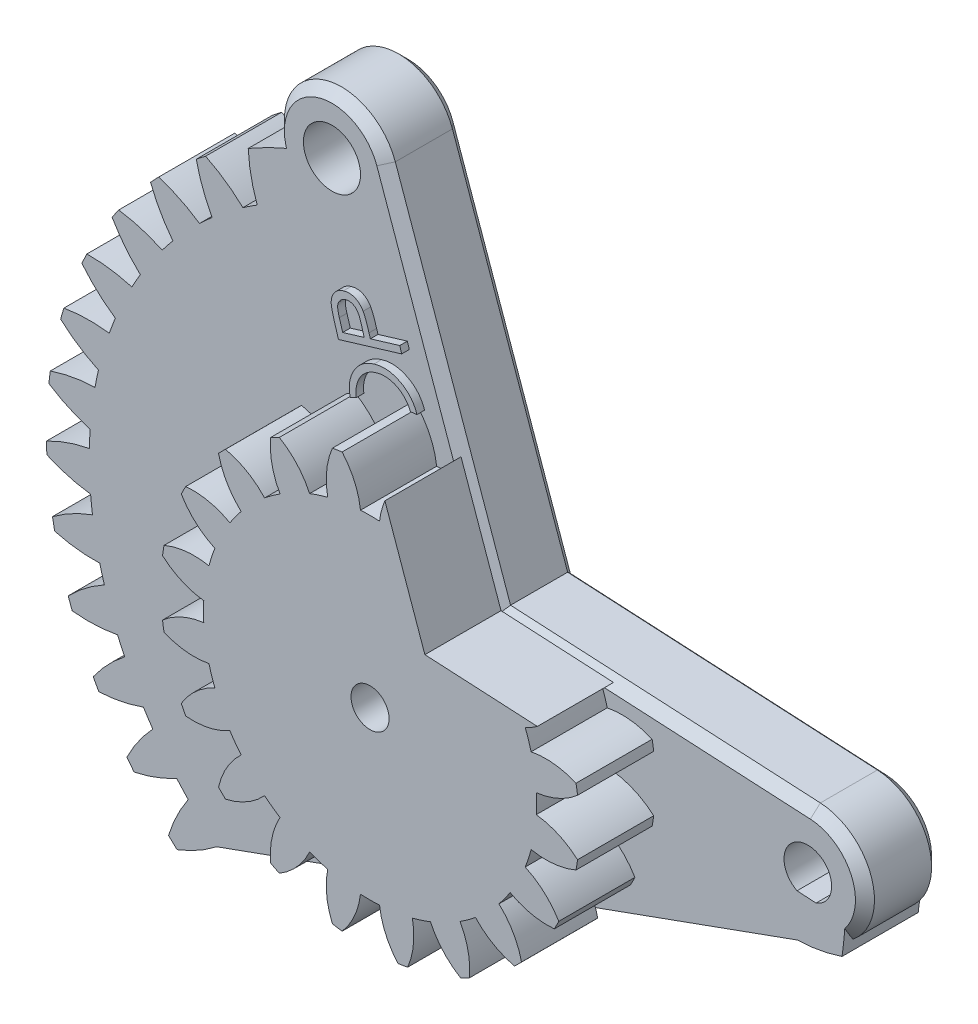
from build123d import *

# Parameters (mm, degrees)
CROQUIS1_R              = 1.5
CROQUIS1_R_2            = 1.25
SALIENTE_EXTRUIR1_DEPTH = 4
CROQUIS2_R              = 2.034729513
CROQUIS2_R_2            = 1.5
SALIENTE_EXTRUIR2_DEPTH = 4
CHAFL_N1_SIZE           = 0.5
SALIENTE_EXTRUIR5_DEPTH = 0.4
SALIENTE_EXTRUIR3_DEPTH = 4
CORTAR_EXTRUIR1_DEPTH   = 10
MATRIZC1_COUNT          = 26
MATRIZC1_ANGLE          = 225
CORTAR_EXTRUIR3_DEPTH   = 10
SALIENTE_EXTRUIR4_START = 4
CROQUIS7_R              = 11
CROQUIS7_R_2            = 1
SALIENTE_EXTRUIR4_DEPTH = 4
CORTAR_EXTRUIR2_DEPTH   = 4
MATRIZC2_COUNT          = 20
CORTAR_EXTRUIR4_DEPTH   = 33.817678254


with BuildPart() as part:
    # Croquis1 → Saliente-Extruir1 (new body)
    with BuildSketch(Plane.XY):
        with BuildLine():
            Line((0.210526316, 3.994455992), (19.157894737, 2.995841994))
            ThreePointArc((19.157894737, 2.995841994), (22, 0), (19.157894737, -2.995841994))
            Line((19.157894737, -2.995841994), (0.210526316, -3.994455992))
            ThreePointArc((0.210526316, -3.994455992), (-4, 0), (0.210526316, 3.994455992))
        make_face()
        Circle(CROQUIS1_R, mode=Mode.SUBTRACT)
        with Locations((19, 0)):
            Circle(CROQUIS1_R_2, mode=Mode.SUBTRACT)
    extrude(amount=SALIENTE_EXTRUIR1_DEPTH)

    # Croquis2 → Saliente-Extruir2 (add, through all)
    with BuildSketch(Plane.XY.offset(4)):
        with BuildLine():
            Line((-3.171102714, 20.998669186), (3.771863049, 1.331558915))
            ThreePointArc((3.771863049, 1.331558915), (1.149391542, -3.831305141), (-3.881954792, -0.964586438))
            Line((-3.881954792, -0.964586438), (-8.911466094, 19.276560172))
            ThreePointArc((-8.911466094, 19.276560172), (-6.862043657, 22.873478856), (-3.171102714, 20.998669186))
        make_face()
        Circle(CROQUIS2_R, mode=Mode.SUBTRACT)
        with Locations((-6, 20)):
            Circle(CROQUIS2_R_2, mode=Mode.SUBTRACT)
    extrude(amount=-SALIENTE_EXTRUIR2_DEPTH)

    # Chaflán1
    chafl_n1_edges = [part.edges().sort_by_distance(p)[0] for p in [
        (22, 0, 4),
        (11.01969335, 3.424762868, 4),
        (-2.380099608, -3.214829056, 0),
        (-2.380099608, -3.214829056, 4),
        (-0.144805375, 12.426176464, 0),
        (-0.144805375, 12.426176464, 4),
        (-6.862043657, 22.873478856, 4),
        (-6.396710443, 9.155986867, 4),
        (-6.862043657, 22.873478856, 0),
        (-6.396710443, 9.155986867, 0),
        (11.01969335, 3.424762868, 0),
        (22, 0, 0),
        (9.684210526, -3.495148993, 0),
        (9.684210526, -3.495148993, 4),
    ]]
    chamfer(chafl_n1_edges, length=CHAFL_N1_SIZE)

    # Croquis11 → Saliente-Extruir5 (add)
    # profile 1 of 3: a face of its own
    with BuildSketch(Plane.XY.offset(4)):
        Polygon((-3.019731571, 6.07953487), (-3.342247596, 5.98207894), (-3.892628205, 7.803593364), (-3.570112179, 7.901049293), (-3.346454327, 7.160664678), (-0.349158654, 8.065812915), (-0.246794872, 7.727171088), (-3.244090545, 6.822022851), align=None)
    # profile 2 of 3: a face of its own
    with BuildSketch(Plane.XY.offset(4)):
        with BuildLine():
            add(Edge.make_bspline(
                [(-4.600373639, 9.844689483), (-4.617377309, 9.906828363), (-4.650766398, 10.028846768), (-4.681106485, 10.213624807), (-4.692288801, 10.395654825), (-4.686093229, 10.574591738), (-4.662463744, 10.750968102), (-4.618925017, 10.92387398), (-4.558700516, 11.094366673), (-4.479898709, 11.259356988), (-4.387961102, 11.416997563), (-4.281592999, 11.562073237), (-4.163122185, 11.693330207), (-4.032717128, 11.810993871), (-3.890509527, 11.915341439), (-3.736003405, 12.005194828), (-3.569586544, 12.081887425), (-3.452133861, 12.120503488), (-3.392340787, 12.140162239)],
                knots=[0, 0, 0, 0, 1.067745278, 2.096667575, 3.098425571, 4.087252053, 5.061165424, 6.043370574, 7.038661181, 8.0545099, 9.070742928, 10.060563721, 11.03187526, 11.997713355, 12.968158645, 13.951189127, 14.956986788, 16, 16, 16, 16], degree=3))
            add(Edge.make_bspline(
                [(-3.392340787, 12.140162239), (-3.332324211, 12.156801675), (-3.213914126, 12.189630557), (-3.033785776, 12.217229453), (-2.855844807, 12.226924609), (-2.68001084, 12.220745313), (-2.506497695, 12.193974405), (-2.335145349, 12.150536487), (-2.166291028, 12.088099729), (-2.001433259, 12.009290658), (-1.844034202, 11.916465432), (-1.698744389, 11.809975317), (-1.566870376, 11.691918282), (-1.449346649, 11.561553374), (-1.345587824, 11.419593647), (-1.255671255, 11.266006476), (-1.179002269, 11.100578792), (-1.14080655, 10.983752204), (-1.121407293, 10.924417047)],
                knots=[0, 0, 0, 0, 1.041314901, 2.054468872, 3.04135589, 4.019684798, 4.992410558, 5.973026333, 6.972567252, 7.99922824, 9.026588938, 10.025311154, 11.008262918, 11.98278676, 12.956494417, 13.944991366, 14.956279872, 16, 16, 16, 16], degree=3))
            add(Edge.make_bspline(
                [(-1.121407293, 10.924417047), (-1.104538299, 10.86369875), (-1.071315214, 10.744115503), (-1.042968761, 10.56215905), (-1.03229356, 10.382787117), (-1.039012612, 10.205852396), (-1.064568798, 10.031267986), (-1.108384238, 9.859193995), (-1.169598227, 9.689269338), (-1.248854112, 9.524423963), (-1.341418986, 9.367272708), (-1.447377628, 9.222610001), (-1.563953179, 9.091430168), (-1.692563992, 8.974303652), (-1.832314042, 8.870660875), (-1.984405223, 8.782473131), (-2.146903484, 8.706095567), (-2.261907735, 8.668416413), (-2.320325562, 8.649276822)],
                knots=[0, 0, 0, 0, 1.055460304, 2.078704063, 3.079242884, 4.063167456, 5.040866377, 6.030760495, 7.034361416, 8.062787363, 9.091914224, 10.086878968, 11.063376702, 12.028241522, 12.997310911, 13.973407922, 14.970567571, 16, 16, 16, 16], degree=3))
            add(Edge.make_bspline(
                [(-2.320325562, 8.649276822), (-2.360165922, 8.638046645), (-2.439056147, 8.615809114), (-2.558934493, 8.591047635), (-2.678951753, 8.575392436), (-2.798769851, 8.56578164), (-2.918754888, 8.565076684), (-3.038350865, 8.573248107), (-3.158367398, 8.587563097), (-3.277411694, 8.611077428), (-3.395000903, 8.640545887), (-3.508565871, 8.678878999), (-3.618524946, 8.723021702), (-3.724483549, 8.774185722), (-3.826528495, 8.832678813), (-3.924530921, 8.89795828), (-4.019165386, 8.969517181), (-4.108340983, 9.048848382), (-4.192709181, 9.133051892), (-4.27117339, 9.221856869), (-4.342598981, 9.31526645), (-4.407859989, 9.412592087), (-4.466430631, 9.514249193), (-4.518281483, 9.620075519), (-4.563434008, 9.730448361), (-4.588000839, 9.80642482), (-4.600373639, 9.844689483)],
                knots=[0, 0, 0, 0, 1.040176587, 2.059714426, 3.073227228, 4.080593331, 5.079204126, 6.085747834, 7.091931532, 8.114932457, 9.133589983, 10.136665386, 11.124925803, 12.110126448, 13.091537305, 14.078819626, 15.068039731, 16.070994731, 17.076166284, 18.062539505, 19.047092008, 20.029486807, 21.005804061, 21.993575551, 22.98948758, 24, 24, 24, 24], degree=3))
        make_face()
        with BuildLine():
            add(Edge.make_bspline(
                [(-4.279259857, 9.958271213), (-4.269312302, 9.92800663), (-4.249511617, 9.867764741), (-4.213957968, 9.779798806), (-4.171280256, 9.695731506), (-4.124523618, 9.613772947), (-4.07091202, 9.535332359), (-4.012091333, 9.459746898), (-3.94794649, 9.386901193), (-3.878070632, 9.318152858), (-3.804427867, 9.253110233), (-3.726914792, 9.194126957), (-3.646864087, 9.140680125), (-3.563968451, 9.092855011), (-3.478374859, 9.05096344), (-3.390365819, 9.013886796), (-3.298996444, 8.984120371), (-3.205399833, 8.959482118), (-3.110043708, 8.941336952), (-3.013789456, 8.929345457), (-2.916829141, 8.923816087), (-2.819369473, 8.924261241), (-2.72125967, 8.932340326), (-2.622704546, 8.946365904), (-2.52325193, 8.96639471), (-2.457859974, 8.985346412), (-2.42479271, 8.994929867)],
                knots=[0, 0, 0, 0, 0.986488523, 1.963613084, 2.934660639, 3.904223514, 4.883864577, 5.874142664, 6.868907043, 7.887376029, 8.908003008, 9.909746802, 10.901399321, 11.887117554, 12.871133705, 13.851015371, 14.842060203, 15.844457459, 16.846619518, 17.845797621, 18.846285572, 19.852360406, 20.861554536, 21.892294059, 22.934179769, 24, 24, 24, 24], degree=3))
            add(Edge.make_bspline(
                [(-2.42479271, 8.994929867), (-2.376728112, 9.010508091), (-2.282070374, 9.041187624), (-2.148536839, 9.104131847), (-2.023883426, 9.17616203), (-1.908496334, 9.259237796), (-1.803906778, 9.354481993), (-1.708603781, 9.46044699), (-1.622741834, 9.577312494), (-1.547865176, 9.704133404), (-1.484528695, 9.83694442), (-1.43410054, 9.97267578), (-1.399049508, 10.110197067), (-1.377551393, 10.248964035), (-1.371535186, 10.389276358), (-1.379248334, 10.530890215), (-1.401572501, 10.673998445), (-1.427345989, 10.768044945), (-1.44041771, 10.815743169)],
                knots=[0, 0, 0, 0, 1.051357304, 2.070528206, 3.067300111, 4.046749293, 5.025387838, 6.007638833, 7.010358697, 8.040442992, 9.070228255, 10.071174544, 11.051010659, 12.020931756, 12.990523051, 13.970322897, 14.970594403, 16, 16, 16, 16], degree=3))
            add(Edge.make_bspline(
                [(-1.44041771, 10.815743169), (-1.450500785, 10.847447482), (-1.470531334, 10.910429734), (-1.50807923, 11.001683213), (-1.550669898, 11.089299028), (-1.598954748, 11.173043814), (-1.650949438, 11.254192838), (-1.710708747, 11.330358113), (-1.774004795, 11.404177239), (-1.843022803, 11.473331992), (-1.915263793, 11.538663369), (-1.992275812, 11.597325473), (-2.071093987, 11.651385133), (-2.153019171, 11.699815878), (-2.238537638, 11.740573253), (-2.326467761, 11.776673351), (-2.417347199, 11.806901609), (-2.510783782, 11.831325211), (-2.606124892, 11.849515103), (-2.702152612, 11.861457912), (-2.798872088, 11.867032017), (-2.896108604, 11.866621794), (-2.993691265, 11.858365905), (-3.091885471, 11.845302456), (-3.190495764, 11.825036051), (-3.255725842, 11.806598542), (-3.288574761, 11.797313681)],
                knots=[0, 0, 0, 0, 1.026287622, 2.038773261, 3.041891596, 4.030358601, 5.020534278, 6.012992347, 7.015073117, 8.019719906, 9.025918674, 10.018376742, 11.004552119, 11.974293191, 12.951647526, 13.925296163, 14.905971001, 15.904802431, 16.903399501, 17.899023229, 18.888752308, 19.891248233, 20.896852359, 21.908644242, 22.946823653, 24, 24, 24, 24], degree=3))
            add(Edge.make_bspline(
                [(-3.288574761, 11.797313681), (-3.320963418, 11.786956442), (-3.385023329, 11.766471374), (-3.477861705, 11.729157558), (-3.566290592, 11.686298589), (-3.650701466, 11.638326305), (-3.731389118, 11.586133745), (-3.807346679, 11.527982813), (-3.879984154, 11.465767793), (-3.947398796, 11.397775408), (-4.010904513, 11.326134972), (-4.068885864, 11.250776446), (-4.121225952, 11.171492583), (-4.167859954, 11.08882372), (-4.210316469, 11.00314761), (-4.246900393, 10.913663889), (-4.277562415, 10.820590115), (-4.30252182, 10.724764505), (-4.322592081, 10.627731352), (-4.334594822, 10.53017706), (-4.34234377, 10.433298526), (-4.341668398, 10.337037166), (-4.33677324, 10.241394147), (-4.323309476, 10.14647936), (-4.305976258, 10.051564818), (-4.288192592, 9.989464302), (-4.279259857, 9.958271213)],
                knots=[0, 0, 0, 0, 1.053169154, 2.083010774, 3.096537244, 4.095136452, 5.089158406, 6.070923408, 7.056471925, 8.049649788, 9.034506635, 10.020666609, 10.992557904, 11.974990074, 12.959314538, 13.952888158, 14.967138427, 15.99269561, 17.01927452, 18.034041473, 19.035785223, 20.027669181, 21.014015174, 22.000068834, 22.995434578, 24, 24, 24, 24], degree=3))
        make_face(mode=Mode.SUBTRACT)
    # profile 3 of 3: a face of its own
    with BuildSketch(Plane.XY.offset(4)):
        with BuildLine():
            Line((-5.25796548, 12.323086534), (-5.457785191, 12.984244387))
            add(Edge.make_bspline(
                [(-5.457785191, 12.984244387), (-5.47151454, 13.029766491), (-5.497786125, 13.116874611), (-5.532689891, 13.242503029), (-5.562961774, 13.356765318), (-5.588464232, 13.460025548), (-5.608673759, 13.552162755), (-5.624650106, 13.633158244), (-5.634831519, 13.703146838), (-5.637954751, 13.74634239), (-5.639375736, 13.765995188)],
                knots=[0, 0, 0, 0, 1.419308712, 2.715896286, 3.89196083, 4.947804328, 5.890657877, 6.707498429, 7.411947036, 8, 8, 8, 8], degree=3))
            add(Edge.make_bspline(
                [(-5.639375736, 13.765995188), (-5.640331526, 13.791242009), (-5.642218459, 13.841084619), (-5.636531353, 13.915110507), (-5.627189271, 13.987373008), (-5.611560252, 14.057694775), (-5.590767952, 14.126157853), (-5.562771427, 14.192103431), (-5.530765951, 14.256817409), (-5.493042658, 14.319173366), (-5.449515292, 14.377973881), (-5.400951238, 14.433117189), (-5.34688528, 14.483503669), (-5.287670149, 14.529530292), (-5.222738195, 14.569937703), (-5.153282711, 14.606576267), (-5.078414852, 14.638346679), (-5.026034248, 14.655408389), (-4.999251537, 14.664132207)],
                knots=[0, 0, 0, 0, 1.012920482, 1.999721077, 2.974462738, 3.934616193, 4.886722436, 5.841042668, 6.805582077, 7.781766065, 8.760783423, 9.737327659, 10.725864365, 11.721845111, 12.741686893, 13.790308956, 14.87016355, 16, 16, 16, 16], degree=3))
            add(Edge.make_bspline(
                [(-4.999251537, 14.664132207), (-4.972002755, 14.671753425), (-4.918615921, 14.6866852), (-4.83848582, 14.70227345), (-4.76014685, 14.710605596), (-4.683915586, 14.71310086), (-4.609536871, 14.707953837), (-4.537283554, 14.696772078), (-4.46668146, 14.679458378), (-4.398731975, 14.654345887), (-4.332616443, 14.624721783), (-4.270372717, 14.587816089), (-4.210929653, 14.546252936), (-4.154698844, 14.499027045), (-4.101568534, 14.446435808), (-4.051224176, 14.388615728), (-4.005199648, 14.324613984), (-3.977207317, 14.2791598), (-3.962993524, 14.256079323)],
                knots=[0, 0, 0, 0, 1.119054162, 2.192492843, 3.224727499, 4.232873013, 5.205809643, 6.169521406, 7.122529883, 8.075941903, 9.03163744, 9.984645917, 10.933699613, 11.898475174, 12.885672038, 13.888504215, 14.927836188, 16, 16, 16, 16], degree=3))
            add(Edge.make_bspline(
                [(-3.962993524, 14.256079323), (-3.952261918, 14.236557778), (-3.9288352, 14.193942936), (-3.895719848, 14.122062336), (-3.859899232, 14.037680497), (-3.82232609, 13.940616299), (-3.783275192, 13.830510156), (-3.740878211, 13.708063972), (-3.697979397, 13.572231844), (-3.668916388, 13.477388645), (-3.653798813, 13.428054483)],
                knots=[0, 0, 0, 0, 0.603734561, 1.317931202, 2.14400041, 3.088751276, 4.138835996, 5.310898922, 6.601222324, 8, 8, 8, 8], degree=3))
            Line((-3.653798813, 13.428054483), (-3.58228439, 13.191075316))
            Line((-3.58228439, 13.191075316), (-2.038414198, 13.65732131))
            Line((-2.038414198, 13.65732131), (-1.938153781, 13.325690701))
            Line((-1.938153781, 13.325690701), (-5.25796548, 12.323086534))
        make_face()
        with BuildLine():
            Line((-5.035709871, 12.752173073), (-3.906903781, 13.092918265))
            Line((-3.906903781, 13.092918265), (-4.069564037, 13.65732131))
            add(Edge.make_bspline(
                [(-4.069564037, 13.65732131), (-4.078101958, 13.684698471), (-4.09458299, 13.737545517), (-4.120210139, 13.813510218), (-4.14731918, 13.882585711), (-4.172488385, 13.946377837), (-4.200360108, 14.002667711), (-4.226521169, 14.053730656), (-4.253932313, 14.097884147), (-4.28991452, 14.148012923), (-4.338856134, 14.201869257), (-4.40512417, 14.254913729), (-4.478899268, 14.296242907), (-4.558361622, 14.326024064), (-4.641501128, 14.34434521), (-4.726296968, 14.349945953), (-4.811994961, 14.343301774), (-4.867838948, 14.328697243), (-4.896186633, 14.32128365)],
                knots=[0, 0, 0, 0, 1.139265612, 2.199162311, 3.183674442, 4.087102138, 4.921745157, 5.677589892, 6.365493384, 6.983916987, 8.127411625, 9.243864779, 10.34131839, 11.472497674, 12.60337212, 13.710677677, 14.837887631, 16, 16, 16, 16], degree=3))
            add(Edge.make_bspline(
                [(-4.896186633, 14.32128365), (-4.923186744, 14.312067035), (-4.976575286, 14.293842606), (-5.050235272, 14.251929009), (-5.117312808, 14.20076549), (-5.175730674, 14.13953092), (-5.225758902, 14.072395907), (-5.263154339, 13.998947412), (-5.289630161, 13.92190345), (-5.301225968, 13.853574049), (-5.302474616, 13.795208872), (-5.301383192, 13.745761634), (-5.295233376, 13.691034397), (-5.286113474, 13.630932022), (-5.273532539, 13.56536819), (-5.256089436, 13.494781012), (-5.237074672, 13.418281108), (-5.221275541, 13.36605712), (-5.213093685, 13.339012015)],
                knots=[0, 0, 0, 0, 1.160535196, 2.294778777, 3.43596018, 4.587863825, 5.732854997, 6.836201972, 7.932619965, 9.042852679, 9.64323445, 10.310261499, 11.057114524, 11.885576692, 12.787847795, 13.7766676, 14.848608427, 16, 16, 16, 16], degree=3))
            Line((-5.213093685, 13.339012015), (-5.035709871, 12.752173073))
        make_face(mode=Mode.SUBTRACT)
    extrude(amount=SALIENTE_EXTRUIR5_DEPTH)

    # Croquis5 → Saliente-Extruir3 (add, through all)
    with BuildSketch(Plane.XY.offset(4)):
        with BuildLine():
            Line((-8.12542173, 19.364336335), (-0.386924844, 0.922111254))
            ThreePointArc((-0.386924844, 0.922111254), (-0.578520438, -0.815667887), (0.998180987, -0.060288623))
            Line((0.998180987, -0.060288623), (20.961800718, -1.266061076))
            ThreePointArc((20.961800718, -1.266061076), (-12.148929201, -17.129025637), (-8.12542173, 19.364336335))
        make_face()
    extrude(amount=-SALIENTE_EXTRUIR3_DEPTH)

    # Croquis4 → Cortar-Extruir1 (cut)
    with BuildSketch(Plane.XY):
        with BuildLine():
            ThreePointArc((-9.927829924, 15.904816692), (-10.305597324, 15.662683831), (-10.677462175, 15.411580143))
            ThreePointArc((-10.677462175, 15.411580143), (-11.618969557, 16.172794781), (-12.664568115, 16.783210647))
            ThreePointArc((-12.664568115, 16.783210647), (-11.556846017, 17.564360373), (-10.401093383, 18.272512186))
            ThreePointArc((-10.401093383, 18.272512186), (-10.254302252, 17.070706778), (-9.927829924, 15.904816692))
        make_face()
    cortar_extruir1 = extrude(amount=CORTAR_EXTRUIR1_DEPTH, mode=Mode.SUBTRACT)

    # MatrizC1: Cortar-Extruir1 ×26 about axis
    matrizc1_axis = Axis((0, 0, 0), (0, 0, 1))
    for i in range(1, MATRIZC1_COUNT):
        add(cortar_extruir1.rotate(matrizc1_axis, i * MATRIZC1_ANGLE / (MATRIZC1_COUNT - 1)), mode=Mode.SUBTRACT)

    # Croquis9 → Cortar-Extruir3 (cut)
    with BuildSketch(Plane.XY.offset(4)):
        Polygon((-12.058511391, -14.356785992), (18.447738738, -3.347526918), (41.792644194, -9.999013948), (3.330495337, -34.929313287), (-27.12510491, -28.428214003), align=None)
    extrude(amount=-CORTAR_EXTRUIR3_DEPTH, mode=Mode.SUBTRACT)

    # Croquis7 → Saliente-Extruir4 (add)
    with BuildSketch(Plane.XY.offset(4).offset(SALIENTE_EXTRUIR4_START)):
        with Locations(Location((0, 0, 0), (0, 0, 114.920843364))):
            Circle(CROQUIS7_R)
        Circle(CROQUIS7_R_2, mode=Mode.SUBTRACT)
    extrude(amount=-SALIENTE_EXTRUIR4_DEPTH)

    # Croquis8 → Cortar-Extruir2 (cut)
    with BuildSketch(Plane.XY.offset(8)):
        with BuildLine():
            ThreePointArc((0.499924007, 8.734705318), (0, 8.749), (-0.499924007, 8.734705318))
            ThreePointArc((-0.499924007, 8.734705318), (-0.824302243, 9.905497836), (-1.485192705, 10.924909509))
            ThreePointArc((-1.485192705, 10.924909509), (0, 11.0254), (1.485192705, 10.924909509))
            ThreePointArc((1.485192705, 10.924909509), (0.824302243, 9.905497836), (0.499924007, 8.734705318))
        make_face()
    cortar_extruir2 = extrude(amount=-CORTAR_EXTRUIR2_DEPTH, mode=Mode.SUBTRACT)

    # MatrizC2: Cortar-Extruir2 ×20 about axis
    matrizc2_axis = Axis((0, 0, 0), (0, 0, 1))
    for i in range(1, MATRIZC2_COUNT):
        add(cortar_extruir2.rotate(matrizc2_axis, i * 360 / MATRIZC2_COUNT), mode=Mode.SUBTRACT)

    # Croquis10 → Cortar-Extruir4 (cut, through all)
    with BuildSketch(Plane.XY.offset(8)):
        Polygon((-3.171102714, 20.998669186), (2.881491963, 3.853683742), (19.157894737, 2.995841994), (14.48034999, 14.875561219), align=None)
    extrude(amount=-CORTAR_EXTRUIR4_DEPTH, mode=Mode.SUBTRACT)


solid = part.part
